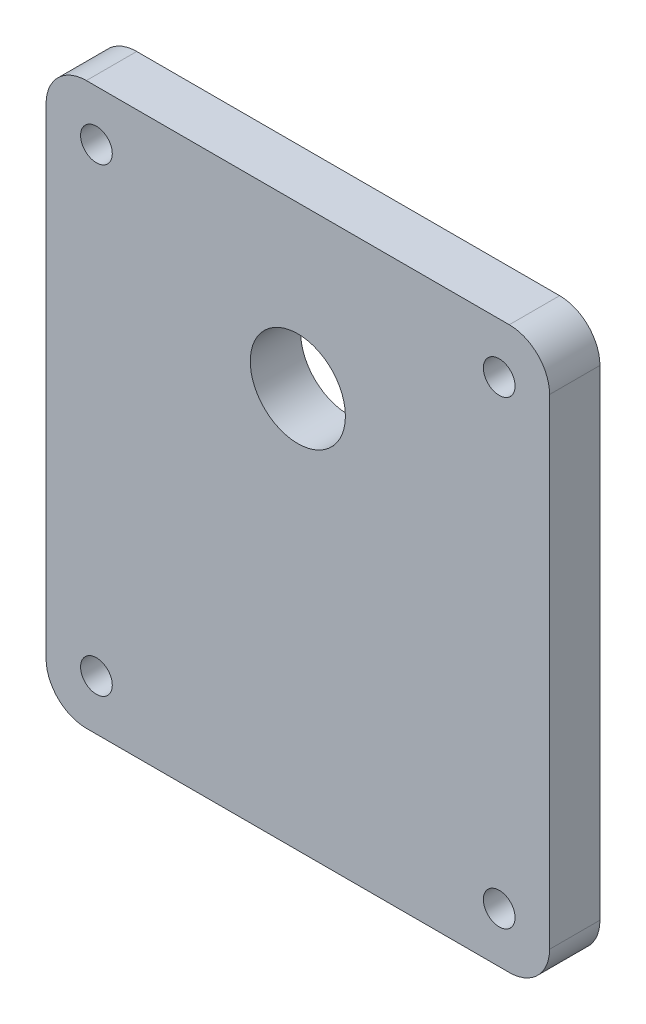
from build123d import *

# Parameters (mm, degrees)
BOSS_EXTRUDE1_DEPTH = 6.35
SKETCH2_R           = 1.35
SKETCH2_R_2         = 1.385
CUT_EXTRUDE1_DEPTH  = 38.116505762
SKETCH3_W           = 63.5
SKETCH3_H           = 71.12
SKETCH3_W_2         = 38.321076004
SKETCH3_H_2         = 47.237540142
BOSS_EXTRUDE2_DEPTH = 6.35
SKETCH5_W           = 27.94
SKETCH5_H           = 55.88
CUT_EXTRUDE3_DEPTH  = 51.07984184
SKETCH7_W           = 69.85
SKETCH7_H           = 0.368341575
CUT_EXTRUDE4_DEPTH  = 10
SKETCH9_R           = 2
CUT_EXTRUDE5_DEPTH  = 51.07984184
SKETCH10_W          = 41.322373354
SKETCH10_H          = 59.668082212
BOSS_EXTRUDE3_DEPTH = 6.35
SKETCH11_R          = 6
CUT_EXTRUDE6_DEPTH  = 51.07984184
FILLET1_R           = 5.08
FILLET2_R           = 5.08
FILLET3_R           = 5.08


with BuildPart() as part:
    # Sketch1 → Boss-Extrude1 (new body)
    with BuildSketch(Plane.XY):
        with BuildLine():
            Line((-19.69889026, 23.2987845), (-14.850045261, 29.75147823))
            ThreePointArc((-14.850045261, 29.75147823), (-14.144755454, 30.339267512), (-13.251155001, 30.55))
            Line((-13.251155001, 30.55), (13.251155001, 30.55))
            ThreePointArc((13.251155001, 30.55), (14.144755454, 30.339267512), (14.850045261, 29.75147823))
            Line((14.850045261, 29.75147823), (19.69889026, 23.2987845))
            ThreePointArc((19.69889026, 23.2987845), (19.997074131, 22.730638521), (20.1, 22.09730627))
            Line((20.1, 22.09730627), (20.1, -22.09730627))
            ThreePointArc((20.1, -22.09730627), (19.997074131, -22.730638521), (19.69889026, -23.2987845))
            Line((19.69889026, -23.2987845), (14.850045261, -29.75147823))
            ThreePointArc((14.850045261, -29.75147823), (14.144755454, -30.339267512), (13.251155001, -30.55))
            Line((13.251155001, -30.55), (-13.251155001, -30.55))
            ThreePointArc((-13.251155001, -30.55), (-14.144755454, -30.339267512), (-14.850045261, -29.75147823))
            Line((-14.850045261, -29.75147823), (-19.69889026, -23.2987845))
            ThreePointArc((-19.69889026, -23.2987845), (-19.997074131, -22.730638521), (-20.1, -22.09730627))
            Line((-20.1, -22.09730627), (-20.1, 22.09730627))
            ThreePointArc((-20.1, 22.09730627), (-19.997074131, 22.730638521), (-19.69889026, 23.2987845))
        make_face()
    extrude(amount=-BOSS_EXTRUDE1_DEPTH)

    # Sketch2 → Cut-Extrude1 (cut, through all)
    with BuildSketch(Plane(origin=(0, 0, -6.35), x_dir=(-1, 0, 0), z_dir=(0, 0, -1))):
        with Locations((17.3, 21.9487845)):
            Circle(SKETCH2_R)
        with Locations((17.3, -0.0512155)):
            Circle(SKETCH2_R)
        with Locations((17.3, -22.0512155)):
            Circle(SKETCH2_R)
        with Locations((11, -27.75)):
            Circle(SKETCH2_R_2)
        with Locations(Location((-11, -27.75, 0), (0, 0, 180))):
            Circle(SKETCH2_R_2)
        with Locations(Location((-17.3, -22.0512155, 0), (0, 0, 180))):
            Circle(SKETCH2_R)
        with Locations(Location((-17.3, -0.0512155, 0), (0, 0, 180))):
            Circle(SKETCH2_R)
        with Locations(Location((-17.3, 21.9487845, 0), (0, 0, 180))):
            Circle(SKETCH2_R)
    extrude(amount=-CUT_EXTRUDE1_DEPTH, mode=Mode.SUBTRACT)

    # Sketch3 → Boss-Extrude2 (add)
    with BuildSketch(Plane(origin=(0, 0, -6.35), x_dir=(-1, 0, 0), z_dir=(0, 0, -1))):
        with Locations((0, 2.6447845)):
            Rectangle(SKETCH3_W, SKETCH3_H)
        Rectangle(SKETCH3_W_2, SKETCH3_H_2, mode=Mode.SUBTRACT)
    extrude(amount=-BOSS_EXTRUDE2_DEPTH)

    # Sketch5 → Cut-Extrude3 (cut, through all)
    with BuildSketch(Plane.XY):
        with Locations((0, 3.0087845)):
            Rectangle(SKETCH5_W, SKETCH5_H)
    extrude(amount=-CUT_EXTRUDE3_DEPTH, mode=Mode.SUBTRACT)

    # Sketch7 → Cut-Extrude4 (cut)
    with BuildSketch(Plane.XY):
        with Locations((3.175, -32.731044713)):
            Rectangle(SKETCH7_W, SKETCH7_H)
    extrude(amount=-CUT_EXTRUDE4_DEPTH, mode=Mode.SUBTRACT)

    # Sketch9 → Cut-Extrude5 (cut, through all)
    with BuildSketch(Plane.XY):
        with Locations((25.4, 31.8547845)):
            Circle(SKETCH9_R)
        with Locations((-25.4, 31.8547845)):
            Circle(SKETCH9_R)
        with Locations((-25.4, -26.196873925)):
            Circle(SKETCH9_R)
        with Locations((25.4, -26.196873925)):
            Circle(SKETCH9_R)
    extrude(amount=-CUT_EXTRUDE5_DEPTH, mode=Mode.SUBTRACT)

    # Sketch10 → Boss-Extrude3 (add)
    with BuildSketch(Plane(origin=(0, 0, -6.35), x_dir=(-1, 0, 0), z_dir=(0, 0, -1))):
        with Locations((0, 2.205557414)):
            Rectangle(SKETCH10_W, SKETCH10_H)
    extrude(amount=-BOSS_EXTRUDE3_DEPTH)

    # Sketch11 → Cut-Extrude6 (cut, through all)
    with BuildSketch(Plane.XY):
        with Locations((0, 17.8847845)):
            Circle(SKETCH11_R)
    extrude(amount=-CUT_EXTRUDE6_DEPTH, mode=Mode.SUBTRACT)

    # Fillet1
    fillet1_edges = [part.edges().sort_by_distance(p)[0] for p in [
        (-31.75, 38.2047845, -3.175),
    ]]
    fillet(fillet1_edges, radius=FILLET1_R)

    # Fillet2
    fillet2_edges = [part.edges().sort_by_distance(p)[0] for p in [
        (31.75, -32.546873925, -3.175),
        (31.75, 38.2047845, -3.175),
    ]]
    fillet(fillet2_edges, radius=FILLET2_R)

    # Fillet3
    fillet3_edges = [part.edges().sort_by_distance(p)[0] for p in [
        (-31.75, -32.546873925, -3.175),
    ]]
    fillet(fillet3_edges, radius=FILLET3_R)


solid = part.part
